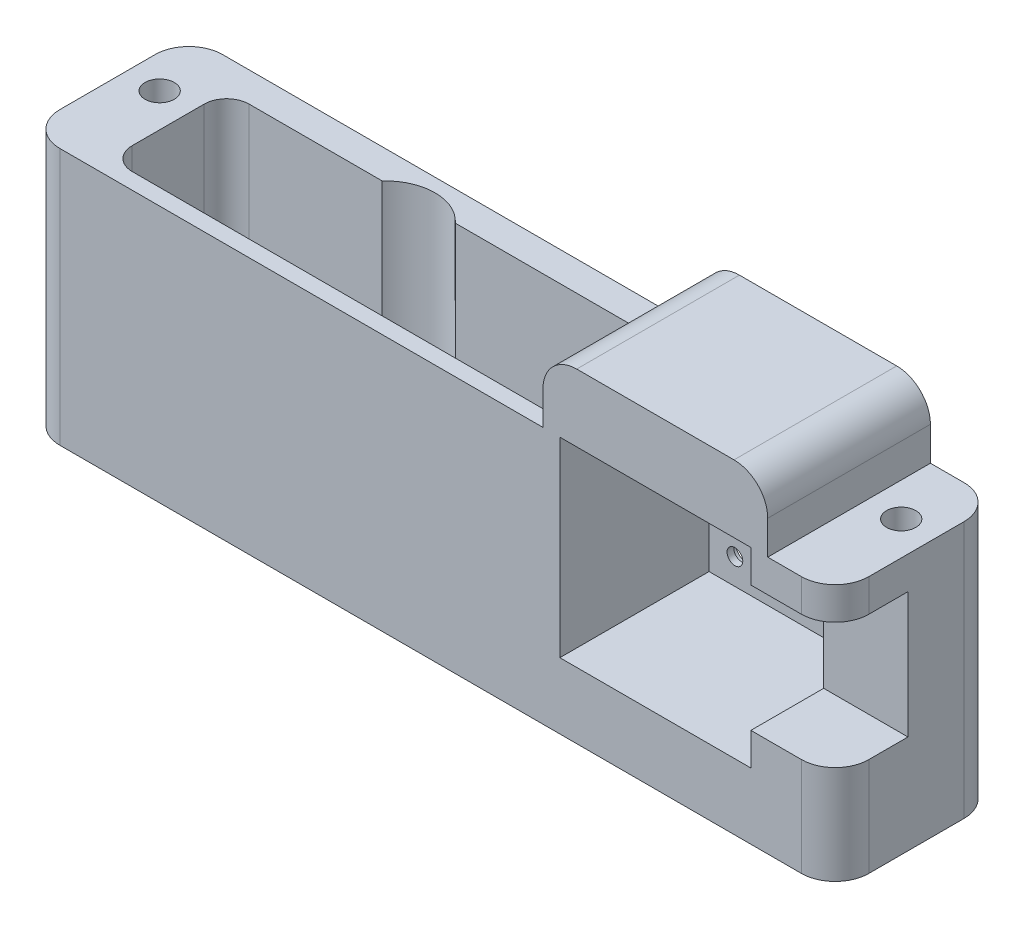
from build123d import *

# Parameters (mm, degrees)
SKETCH1_W           = 180
SKETCH1_H           = 57.2
SKETCH1_W_2         = 50
SKETCH1_H_2         = 15
BOSS_EXTRUDE1_DEPTH = 36.2
SKETCH2_R           = 3.25
SKETCH2_R_2         = 5.75
SKETCH2_R_3         = 1.75
CUT_EXTRUDE1_DEPTH  = 57.2
FILLET1_R           = 7.5
CUT_EXTRUDE3_START  = -52.2
SKETCH3_R           = 1.75
SKETCH3_R_2         = 5.75
CUT_EXTRUDE3_DEPTH  = 52.2
SKETCH4_W           = 42.5
SKETCH4_H           = 42.5
SKETCH4_R           = 11.25
SKETCH4_R_2         = 1.75
CUT_EXTRUDE4_DEPTH  = 33.2
SKETCH4_3_R         = 11.25
SKETCH4_3_R_2       = 1.75
CUT_EXTRUDE5_DEPTH  = 36.2
FILLET2_R           = 7.5
SKETCH8_R           = 3
CUT_EXTRUDE8_DEPTH  = 1.5
SKETCH7_R           = 3.25
CUT_EXTRUDE7_DEPTH  = 36.2
SKETCH7_2_R         = 3.25
BOSS_EXTRUDE3_DEPTH = 22.4
CUT_EXTRUDE9_REACH  = 190.71
SKETCH9_W           = 16.2
SKETCH9_H           = 28


with BuildPart() as part:
    # Sketch1 → Boss-Extrude1 (new body)
    with BuildSketch(Plane.XY):
        Rectangle(SKETCH1_W, SKETCH1_H)
        with Locations((50, 36.1)):
            Rectangle(SKETCH1_W_2, SKETCH1_H_2)
    extrude(amount=BOSS_EXTRUDE1_DEPTH)

    # Sketch2 → Cut-Extrude1 (cut)
    with BuildSketch(Plane.XZ.offset(28.6)):
        with Locations(Location((-82.5, 14, 0), (0, 0, 270))):
            Circle(SKETCH2_R)
        with Locations(Location((-32.25, 14, 0), (0, 0, 270))):
            Circle(SKETCH2_R_2)
        with Locations(Location((-37.906854249, 19.656854249, 0), (0, 0, 270))):
            Circle(SKETCH2_R_3)
        with Locations(Location((-26.593145751, 19.656854249, 0), (0, 0, 270))):
            Circle(SKETCH2_R_3)
        with Locations(Location((-37.906854249, 8.343145751, 0), (0, 0, 270))):
            Circle(SKETCH2_R_3)
        with Locations(Location((-26.593145751, 8.343145751, 0), (0, 0, 270))):
            Circle(SKETCH2_R_3)
        with Locations(Location((82.5, 14, 0), (0, 0, 270))):
            Circle(SKETCH2_R)
    extrude(amount=-CUT_EXTRUDE1_DEPTH, mode=Mode.SUBTRACT)

    # Fillet1
    fillet1_edges = [part.edges().sort_by_distance(p)[0] for p in [
        (-90, 0, 0),
        (90, 0, 0),
        (-90, 0, 36.2),
        (90, 0, 36.2),
    ]]
    fillet(fillet1_edges, radius=FILLET1_R)

    # Sketch3 → Cut-Extrude3 (cut)
    with BuildSketch(Plane(origin=(0, 28.6, 0), x_dir=(1, 0, 0), z_dir=(0, 1, 0)).offset(CUT_EXTRUDE3_START)):
        with BuildLine():
            Line((-40.382558646, -6.593145751), (-70, -6.593145751))
            ThreePointArc((-70, -6.593145751), (-73.535533906, -8.057611845), (-75, -11.593145751))
            Line((-75, -11.593145751), (-75, -27.6))
            ThreePointArc((-75, -27.6), (-73.535533906, -31.135533906), (-70, -32.6))
            Line((-70, -32.6), (25, -32.6))
            Line((25, -32.6), (25, -6.593145751))
            Line((25, -6.593145751), (-24.117441354, -6.593145751))
            ThreePointArc((-24.117441354, -6.593145751), (-32.25, -3), (-40.382558646, -6.593145751))
        make_face()
        with Locations(Location((-26.593145751, -8.343145751, 0), (0, 0, 90))):
            Circle(SKETCH3_R, mode=Mode.SUBTRACT)
        with Locations(Location((-37.906854249, -19.656854249, 0), (0, 0, 90))):
            Circle(SKETCH3_R, mode=Mode.SUBTRACT)
        with Locations(Location((-26.593145751, -19.656854249, 0), (0, 0, 90))):
            Circle(SKETCH3_R, mode=Mode.SUBTRACT)
        with Locations(Location((-37.906854249, -8.343145751, 0), (0, 0, 90))):
            Circle(SKETCH3_R, mode=Mode.SUBTRACT)
        with Locations(Location((-32.25, -14, 0), (0, 0, 90))):
            Circle(SKETCH3_R_2, mode=Mode.SUBTRACT)
    extrude(amount=CUT_EXTRUDE3_DEPTH, mode=Mode.SUBTRACT)

    # Sketch4 → Cut-Extrude4 (cut)
    with BuildSketch(Plane.XY.offset(36.2)):
        with Locations((50, 7.35)):
            Rectangle(SKETCH4_W, SKETCH4_H)
        with Locations((50, 7.35)):
            Circle(SKETCH4_R, mode=Mode.SUBTRACT)
        with Locations((34.5, 22.85)):
            Circle(SKETCH4_R_2, mode=Mode.SUBTRACT)
        with Locations((65.5, 22.85)):
            Circle(SKETCH4_R_2, mode=Mode.SUBTRACT)
        with Locations((65.5, -8.15)):
            Circle(SKETCH4_R_2, mode=Mode.SUBTRACT)
        with Locations((34.5, -8.15)):
            Circle(SKETCH4_R_2, mode=Mode.SUBTRACT)
    extrude(amount=-CUT_EXTRUDE4_DEPTH, mode=Mode.SUBTRACT)

    # Sketch4<3> → Cut-Extrude5 (cut)
    with BuildSketch(Plane.XY.offset(36.2)):
        with Locations((50, 7.35)):
            Circle(SKETCH4_3_R)
        with Locations((34.5, 22.85)):
            Circle(SKETCH4_3_R_2)
        with Locations((65.5, 22.85)):
            Circle(SKETCH4_3_R_2)
        with Locations((65.5, -8.15)):
            Circle(SKETCH4_3_R_2)
        with Locations((34.5, -8.15)):
            Circle(SKETCH4_3_R_2)
    extrude(amount=-CUT_EXTRUDE5_DEPTH, mode=Mode.SUBTRACT)

    # Fillet2
    fillet2_edges = [part.edges().sort_by_distance(p)[0] for p in [
        (25, 43.6, 18.1),
        (75, 43.6, 18.1),
    ]]
    fillet(fillet2_edges, radius=FILLET2_R)

    # Sketch8 → Cut-Extrude8 (cut)
    with BuildSketch(Plane(origin=(0, 0, 0), x_dir=(-1, 0, 0), z_dir=(0, 0, -1))):
        with Locations((-65.5, 22.85)):
            Circle(SKETCH8_R)
        with Locations((-34.5, 22.85)):
            Circle(SKETCH8_R)
        with Locations((-34.5, -8.15)):
            Circle(SKETCH8_R)
        with Locations((-65.5, -8.15)):
            Circle(SKETCH8_R)
    extrude(amount=-CUT_EXTRUDE8_DEPTH, mode=Mode.SUBTRACT)

    # Sketch7 → Cut-Extrude7 (cut)
    with BuildSketch(Plane.XY.offset(36.2)):
        with Locations((50, -21.4)):
            Circle(SKETCH7_R)
        with Locations((50, 36.1)):
            Circle(SKETCH7_R)
    extrude(amount=-CUT_EXTRUDE7_DEPTH, mode=Mode.SUBTRACT)

    # Sketch7<2> → Boss-Extrude3 (add)
    with BuildSketch(Plane.XY.offset(36.2)):
        with Locations((50, -21.4)):
            Circle(SKETCH7_2_R)
        with Locations((50, 36.1)):
            Circle(SKETCH7_2_R)
    extrude(amount=-BOSS_EXTRUDE3_DEPTH)

    # Cut-Extrude9: up to this face of the body (flat: up to its plane)
    cut_extrude9_end = Plane(part.part.faces().sort_by_distance((71.25, 7.35, 19.6))[0])
    # Sketch9 → Cut-Extrude9 (cut, up to the picked face)
    with BuildSketch(Plane(origin=(90, 0, 0), x_dir=(0, 0, -1), z_dir=(1, 0, 0)), mode=Mode.PRIVATE) as cut_extrude9_sk1:
        with Locations((-28.1, 7.35)):
            Rectangle(SKETCH9_W, SKETCH9_H)
    cut_extrude9_tool1 = split(extrude(cut_extrude9_sk1.sketch, amount=-CUT_EXTRUDE9_REACH, mode=Mode.PRIVATE), bisect_by=cut_extrude9_end, keep=Keep.BOTH, mode=Mode.PRIVATE)
    add(cut_extrude9_tool1.solids().sort_by(Axis((90, 7.35, 28.1), (-1, 0, 0)))[0], mode=Mode.SUBTRACT)


solid = part.part
